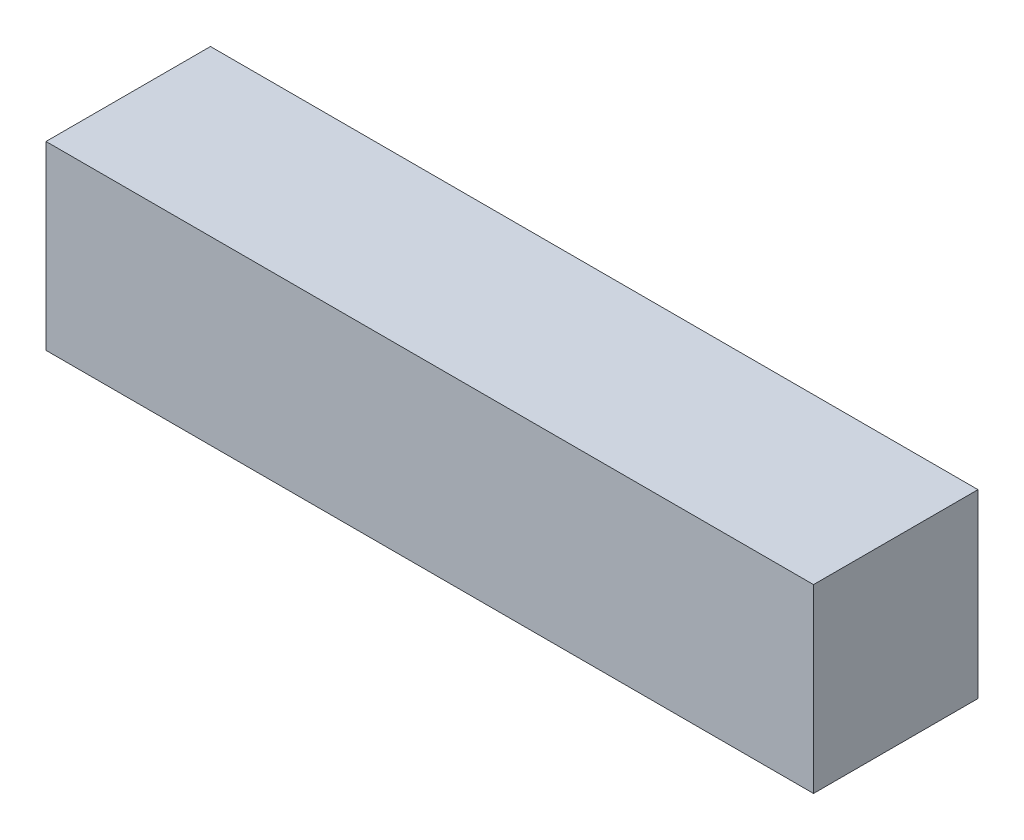
from build123d import *

# Parameters (mm, degrees)
SKETCH1_W           = 88.9
SKETCH1_H           = 20.955
BOSS_EXTRUDE1_DEPTH = 19.05


with BuildPart() as part:
    # Sketch1 → Boss-Extrude1 (new body)
    with BuildSketch(Plane.XY):
        with Locations((44.45, -10.4775)):
            Rectangle(SKETCH1_W, SKETCH1_H)
    extrude(amount=BOSS_EXTRUDE1_DEPTH)


solid = part.part
